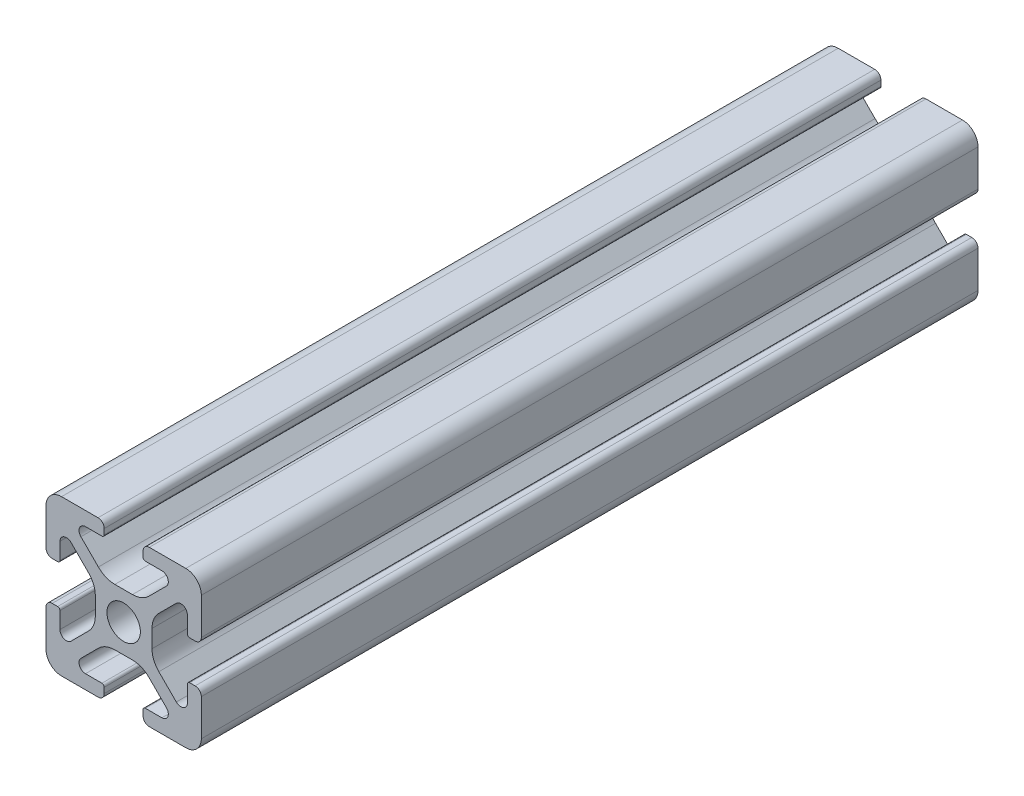
from build123d import *

# Parameters (mm, degrees)
ESQUISSE1_R      = 2.15
EXTRUSION1_DEPTH = 100


with BuildPart() as part:
    # Esquisse1 → Extrusion1 (new body)
    with BuildSketch(Plane(origin=(0, 0, 0), x_dir=(-1, 0, 0), z_dir=(0, 0, -1))):
        with BuildLine():
            Line((-18, 0), (-13.3, 0))
            ThreePointArc((-13.3, 0), (-12.734314575, 0.234314575), (-12.5, 0.8))
            Line((-12.5, 0.8), (-12.5, 1.5))
            ThreePointArc((-12.5, 1.5), (-12.587867966, 1.712132034), (-12.8, 1.8))
            Line((-12.8, 1.8), (-14.918424061, 1.8))
            ThreePointArc((-14.918424061, 1.8), (-15.686700051, 2.313345604), (-15.506437047, 3.219588924))
            Line((-15.506437047, 3.219588924), (-13.254705627, 5.471320344))
            ThreePointArc((-13.254705627, 5.471320344), (-12.281435581, 6.121638598), (-11.133385284, 6.35))
            Line((-11.133385284, 6.35), (-8.866614716, 6.35))
            ThreePointArc((-8.866614716, 6.35), (-7.718564419, 6.121638598), (-6.745294373, 5.471320344))
            Line((-6.745294373, 5.471320344), (-4.493562953, 3.219588924))
            ThreePointArc((-4.493562953, 3.219588924), (-4.313299949, 2.313345604), (-5.081575939, 1.8))
            Line((-5.081575939, 1.8), (-7.2, 1.8))
            ThreePointArc((-7.2, 1.8), (-7.412132034, 1.712132034), (-7.5, 1.5))
            Line((-7.5, 1.5), (-7.5, 0.8))
            ThreePointArc((-7.5, 0.8), (-7.265685425, 0.234314575), (-6.7, 0))
            Line((-6.7, 0), (-2, 0))
            ThreePointArc((-2, 0), (-0.585786438, 0.585786438), (0, 2))
            Line((0, 2), (0, 6.7))
            ThreePointArc((0, 6.7), (-0.234314575, 7.265685425), (-0.8, 7.5))
            Line((-0.8, 7.5), (-1.5, 7.5))
            ThreePointArc((-1.5, 7.5), (-1.712132034, 7.412132034), (-1.8, 7.2))
            Line((-1.8, 7.2), (-1.8, 5.081575939))
            ThreePointArc((-1.8, 5.081575939), (-2.313345604, 4.313299949), (-3.219588924, 4.493562953))
            Line((-3.219588924, 4.493562953), (-5.471320344, 6.745294373))
            ThreePointArc((-5.471320344, 6.745294373), (-6.121638598, 7.718564419), (-6.35, 8.866614716))
            Line((-6.35, 8.866614716), (-6.35, 11.133385284))
            ThreePointArc((-6.35, 11.133385284), (-6.121638598, 12.281435581), (-5.471320344, 13.254705627))
            Line((-5.471320344, 13.254705627), (-3.219588924, 15.506437047))
            ThreePointArc((-3.219588924, 15.506437047), (-2.313345604, 15.686700051), (-1.8, 14.918424061))
            Line((-1.8, 14.918424061), (-1.8, 12.8))
            ThreePointArc((-1.8, 12.8), (-1.712132034, 12.587867966), (-1.5, 12.5))
            Line((-1.5, 12.5), (-0.8, 12.5))
            ThreePointArc((-0.8, 12.5), (-0.234314575, 12.734314575), (0, 13.3))
            Line((0, 13.3), (0, 18))
            ThreePointArc((0, 18), (-0.585786438, 19.414213562), (-2, 20))
            Line((-2, 20), (-6.7, 20))
            ThreePointArc((-6.7, 20), (-7.265685425, 19.765685425), (-7.5, 19.2))
            Line((-7.5, 19.2), (-7.5, 18.5))
            ThreePointArc((-7.5, 18.5), (-7.412132034, 18.287867966), (-7.2, 18.2))
            Line((-7.2, 18.2), (-5.081575939, 18.2))
            ThreePointArc((-5.081575939, 18.2), (-4.313299949, 17.686654396), (-4.493562953, 16.780411076))
            Line((-4.493562953, 16.780411076), (-6.745294373, 14.528679656))
            ThreePointArc((-6.745294373, 14.528679656), (-7.718564419, 13.878361402), (-8.866614716, 13.65))
            Line((-8.866614716, 13.65), (-11.133385284, 13.65))
            ThreePointArc((-11.133385284, 13.65), (-12.281435581, 13.878361402), (-13.254705627, 14.528679656))
            Line((-13.254705627, 14.528679656), (-15.506437047, 16.780411076))
            ThreePointArc((-15.506437047, 16.780411076), (-15.686700051, 17.686654396), (-14.918424061, 18.2))
            Line((-14.918424061, 18.2), (-12.8, 18.2))
            ThreePointArc((-12.8, 18.2), (-12.587867966, 18.287867966), (-12.5, 18.5))
            Line((-12.5, 18.5), (-12.5, 19.2))
            ThreePointArc((-12.5, 19.2), (-12.734314575, 19.765685425), (-13.3, 20))
            Line((-13.3, 20), (-18, 20))
            ThreePointArc((-18, 20), (-19.414213562, 19.414213562), (-20, 18))
            Line((-20, 18), (-20, 13.3))
            ThreePointArc((-20, 13.3), (-19.765685425, 12.734314575), (-19.2, 12.5))
            Line((-19.2, 12.5), (-18.5, 12.5))
            ThreePointArc((-18.5, 12.5), (-18.287867966, 12.587867966), (-18.2, 12.8))
            Line((-18.2, 12.8), (-18.2, 14.918424061))
            ThreePointArc((-18.2, 14.918424061), (-17.686654396, 15.686700051), (-16.780411076, 15.506437047))
            Line((-16.780411076, 15.506437047), (-14.528679656, 13.254705627))
            ThreePointArc((-14.528679656, 13.254705627), (-13.878361402, 12.281435581), (-13.65, 11.133385284))
            Line((-13.65, 11.133385284), (-13.65, 8.866614716))
            ThreePointArc((-13.65, 8.866614716), (-13.878361402, 7.718564419), (-14.528679656, 6.745294373))
            Line((-14.528679656, 6.745294373), (-16.780411076, 4.493562953))
            ThreePointArc((-16.780411076, 4.493562953), (-17.686654396, 4.313299949), (-18.2, 5.081575939))
            Line((-18.2, 5.081575939), (-18.2, 7.2))
            ThreePointArc((-18.2, 7.2), (-18.287867966, 7.412132034), (-18.5, 7.5))
            Line((-18.5, 7.5), (-19.2, 7.5))
            ThreePointArc((-19.2, 7.5), (-19.765685425, 7.265685425), (-20, 6.7))
            Line((-20, 6.7), (-20, 2))
            ThreePointArc((-20, 2), (-19.414213562, 0.585786438), (-18, 0))
        make_face()
        with Locations(Location((-10, 10, 0), (0, 0, 180))):
            Circle(ESQUISSE1_R, mode=Mode.SUBTRACT)
    extrude(amount=-EXTRUSION1_DEPTH)


solid = part.part
